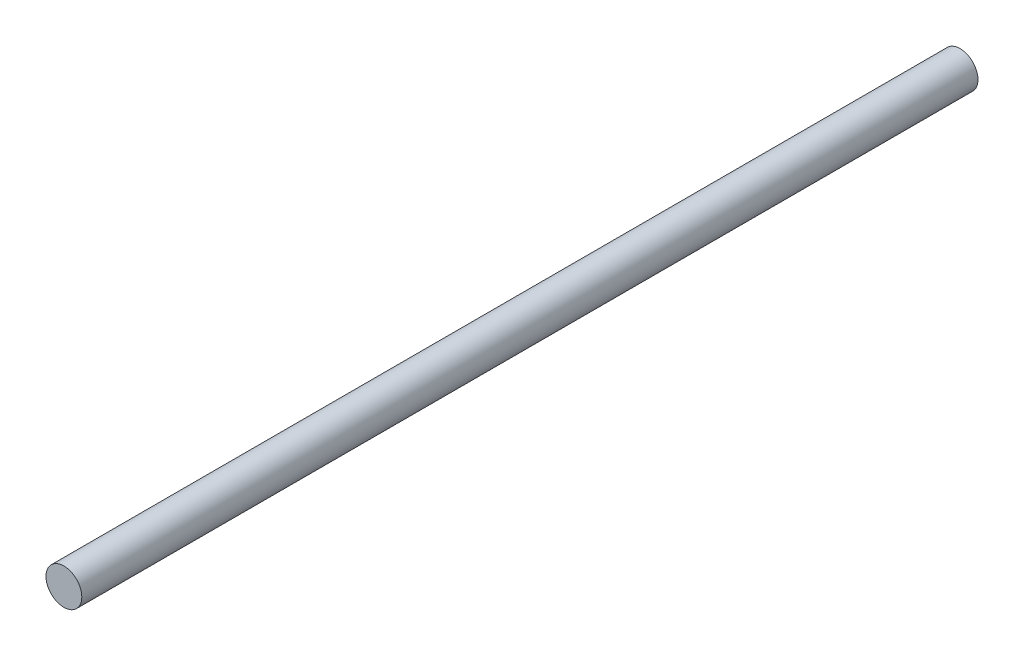
from build123d import *

# Parameters (mm, degrees)
ESBO_O1_R                = 2
RESSALTO_EXTRUS_O1_DEPTH = 100


with BuildPart() as part:
    # Esboço1 → Ressalto-extrusão1 (new body)
    with BuildSketch(Plane.XY.offset(25)):
        with Locations((-24.64943678, -15.559141583)):
            Circle(ESBO_O1_R)
    extrude(amount=RESSALTO_EXTRUS_O1_DEPTH)


solid = part.part
